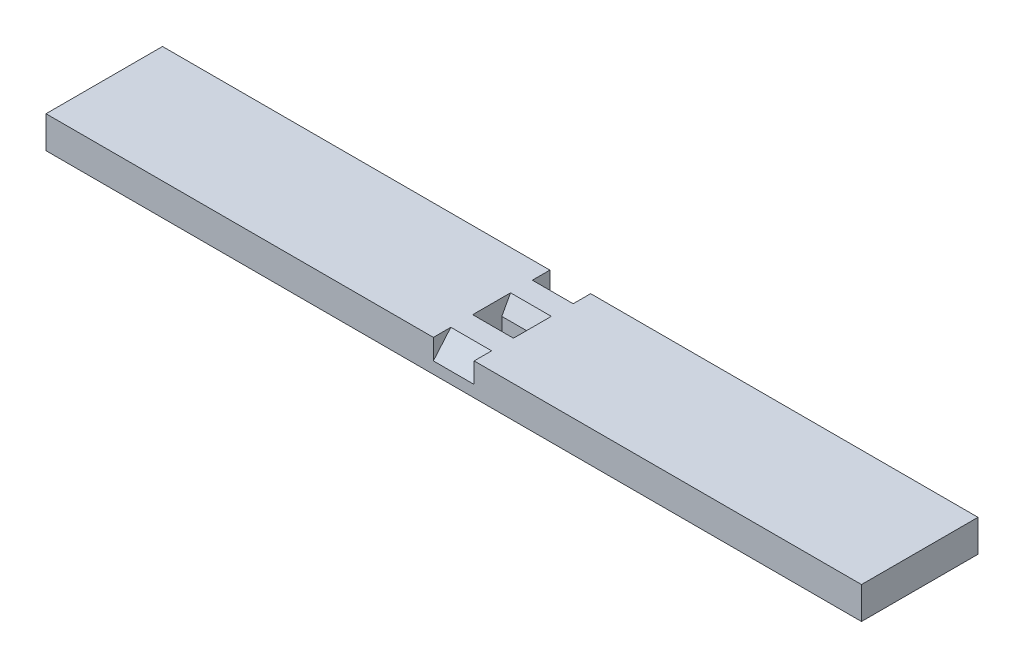
from build123d import *

# Parameters (mm, degrees)
SKETCH1_W           = 140
SKETCH1_H           = 20
BOSS_EXTRUDE1_DEPTH = 5.5
SKETCH2_W           = 7
SKETCH2_H           = 3.5
CUT_EXTRUDE1_DEPTH  = 10
CUT_EXTRUDE2_DEPTH  = 7


with BuildPart() as part:
    # Sketch1 → Boss-Extrude1 (new body)
    with BuildSketch(Plane(origin=(0, 0, 0), x_dir=(1, 0, 0), z_dir=(0, 1, 0))):
        with Locations((70, 10)):
            Rectangle(SKETCH1_W, SKETCH1_H)
    extrude(amount=BOSS_EXTRUDE1_DEPTH)

    # Sketch2 → Cut-Extrude1 (cut)
    with BuildSketch(Plane(origin=(0, 5.5, 0), x_dir=(1, 0, 0), z_dir=(0, 1, 0))):
        with Locations((70, 10)):
            Rectangle(SKETCH2_W, SKETCH2_H)
    extrude(amount=-CUT_EXTRUDE1_DEPTH, mode=Mode.SUBTRACT)

    # Sketch3 → Cut-Extrude2 (cut)
    with BuildSketch(Plane(origin=(66.5, 0, 0), x_dir=(0, 0, -1), z_dir=(1, 0, 0))):
        Polygon((8.25, 5.5), (6.747858335, 5.5), (8.25, 2.75), align=None)
        Polygon((11.75, 5.5), (13.25, 5.5), (11.75, 2.75), align=None)
        Polygon((3, 5.5), (0, 2), (0, 5.5), align=None)
        Polygon((17, 5.5), (20, 2), (20, 5.5), align=None)
    extrude(amount=CUT_EXTRUDE2_DEPTH, mode=Mode.SUBTRACT)


solid = part.part
